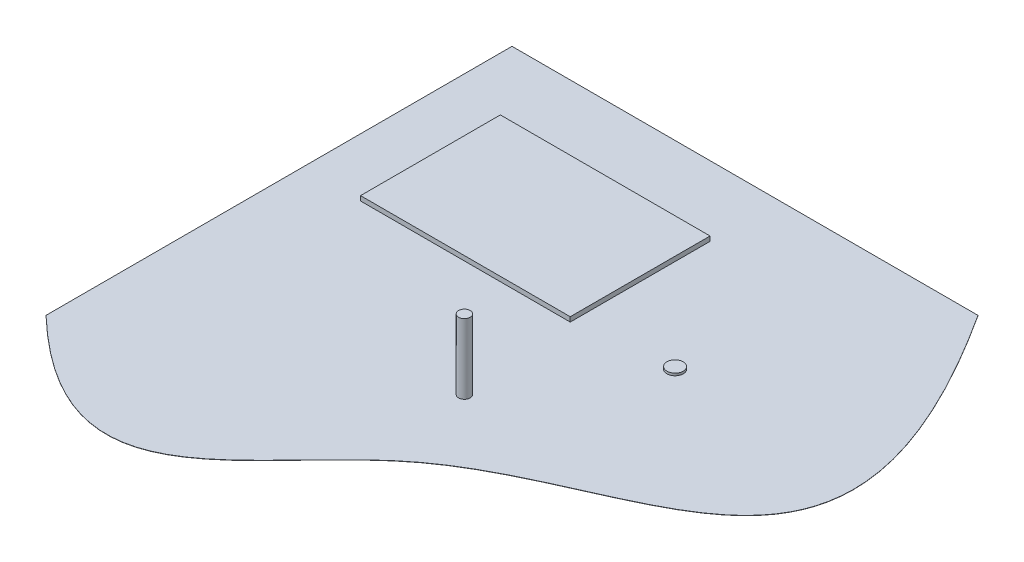
from build123d import *

# Parameters (mm, degrees)
EXTRUDE_1_DEPTH = 10
SKETCH_2_W      = 9000
SKETCH_2_H      = 6000
EXTRUDE_2_DEPTH = 200
SKETCH_3_R      = 350
EXTRUDE_3_DEPTH = 100
SKETCH_4_R      = 250
EXTRUDE_4_DEPTH = 3000


with BuildPart() as part:
    # Эскиз1 → Бобышка-Вытянуть1 (new body)
    with BuildSketch(Plane(origin=(0, 0, 0), x_dir=(1, 0, 0), z_dir=(0, 1, 0))):
        with BuildLine():
            Line((0, 0), (20000, 0))
            add(Edge.make_bspline(
                [(0, -20000), (7198.35283971, -26864.519570208), (12070.505785396, -12028.818977693), (29348.40206024, -14440.696342407), (20000, 0)],
                knots=[0, 0, 0, 0, 0.41355972, 1, 1, 1, 1], degree=3))
            Line((0, -20000), (0, 0))
        make_face()
    extrude(amount=EXTRUDE_1_DEPTH)

    # Эскиз2 → Бобышка-Вытянуть2 (add)
    with BuildSketch(Plane(origin=(0, 10, 0), x_dir=(1, 0, 0), z_dir=(0, 1, 0))):
        with Locations((7000, -6000)):
            Rectangle(SKETCH_2_W, SKETCH_2_H)
    extrude(amount=EXTRUDE_2_DEPTH)


with BuildPart() as body_2:
    # Эскиз3 → Бобышка-Вытянуть3 (new body)
    with BuildSketch(Plane(origin=(0, 10, 0), x_dir=(1, 0, 0), z_dir=(0, 1, 0))):
        with Locations(Location((15500, -8500, 0), (0, 0, 270))):
            Circle(SKETCH_3_R)
    extrude(amount=EXTRUDE_3_DEPTH)


with BuildPart() as body_3:
    # Эскиз4 → Бобышка-Вытянуть4 (new body)
    with BuildSketch(Plane(origin=(0, 10, 0), x_dir=(1, 0, 0), z_dir=(0, 1, 0))):
        with Locations(Location((11923.76789565, -13966.178533957, 0), (0, 0, 270))):
            Circle(SKETCH_4_R)
    extrude(amount=EXTRUDE_4_DEPTH)


solid = Compound([part.part, body_2.part, body_3.part])
